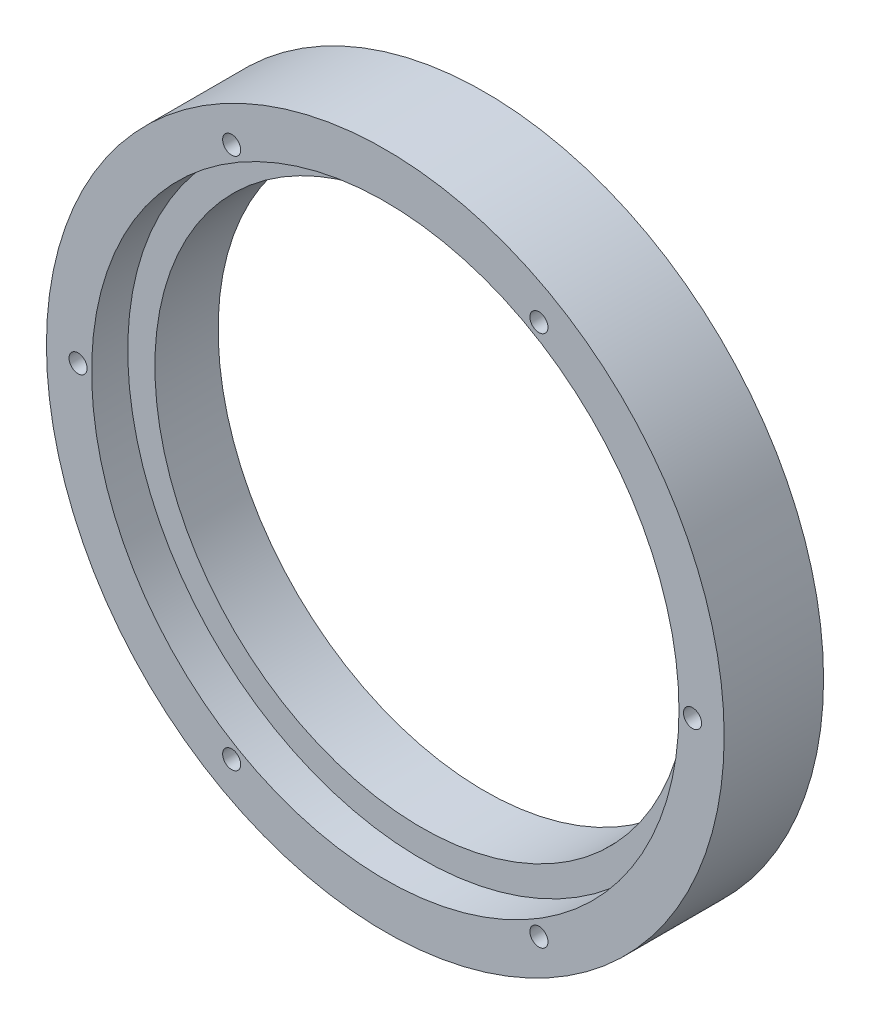
from build123d import *

# Parameters (mm, degrees)
SKETCH1_R           = 37.5
SKETCH1_R_2         = 29.5
BOSS_EXTRUDE1_DEPTH = 11
SKETCH2_R           = 1
CUT_EXTRUDE1_DEPTH  = 11
SKETCH3_R           = 32.5
CUT_EXTRUDE2_DEPTH  = 4


with BuildPart() as part:
    # Sketch1 → Boss-Extrude1 (new body)
    with BuildSketch(Plane.XY):
        Circle(SKETCH1_R)
        Circle(SKETCH1_R_2, mode=Mode.SUBTRACT)
    extrude(amount=BOSS_EXTRUDE1_DEPTH)

    # Sketch2 → Cut-Extrude1 (cut)
    with BuildSketch(Plane(origin=(0, 0, 0), x_dir=(-1, 0, 0), z_dir=(0, 0, -1))):
        with Locations((-17, 29.444863729)):
            Circle(SKETCH2_R)
        with Locations((17, 29.444863729)):
            Circle(SKETCH2_R)
        with Locations((34, 0)):
            Circle(SKETCH2_R)
        with Locations((17, -29.444863729)):
            Circle(SKETCH2_R)
        with Locations((-17, -29.444863729)):
            Circle(SKETCH2_R)
        with Locations((-34, 0)):
            Circle(SKETCH2_R)
    extrude(amount=-CUT_EXTRUDE1_DEPTH, mode=Mode.SUBTRACT)

    # Sketch3 → Cut-Extrude2 (cut)
    with BuildSketch(Plane.XY.offset(11)):
        Circle(SKETCH3_R)
    extrude(amount=-CUT_EXTRUDE2_DEPTH, mode=Mode.SUBTRACT)


solid = part.part
